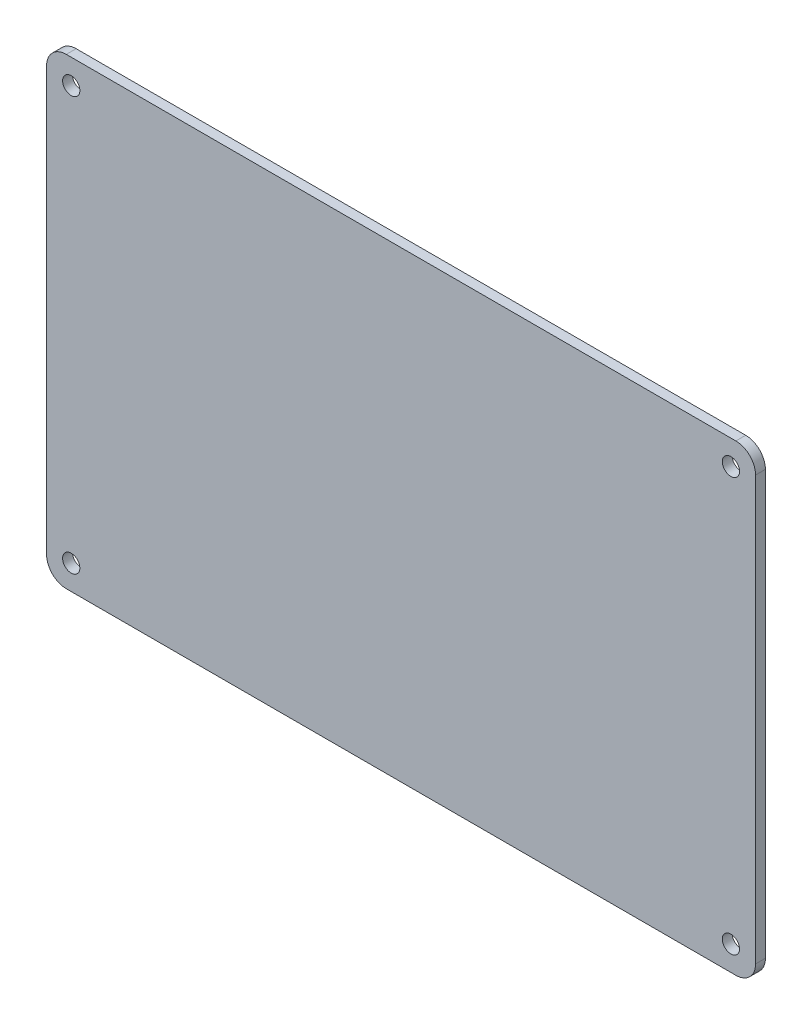
from build123d import *

# Parameters (mm, degrees)
ESBO_O1_R                = 1.75
RESSALTO_EXTRUS_O1_DEPTH = 2


with BuildPart() as part:
    # Esboço1 → Ressalto-extrusão1 (new body)
    with BuildSketch(Plane.XY):
        with BuildLine():
            Line((-68, -47), (68, -47))
            ThreePointArc((68, -47), (70.828427125, -45.828427125), (72, -43))
            Line((72, -43), (72, 43))
            ThreePointArc((72, 43), (70.828427125, 45.828427125), (68, 47))
            Line((68, 47), (-68, 47))
            ThreePointArc((-68, 47), (-70.828427125, 45.828427125), (-72, 43))
            Line((-72, 43), (-72, -43))
            ThreePointArc((-72, -43), (-70.828427125, -45.828427125), (-68, -47))
        make_face()
        with Locations((-67, 42)):
            Circle(ESBO_O1_R, mode=Mode.SUBTRACT)
        with Locations((67, 42)):
            Circle(ESBO_O1_R, mode=Mode.SUBTRACT)
        with Locations((-67, -42)):
            Circle(ESBO_O1_R, mode=Mode.SUBTRACT)
        with Locations((67, -42)):
            Circle(ESBO_O1_R, mode=Mode.SUBTRACT)
    extrude(amount=RESSALTO_EXTRUS_O1_DEPTH)


solid = part.part
